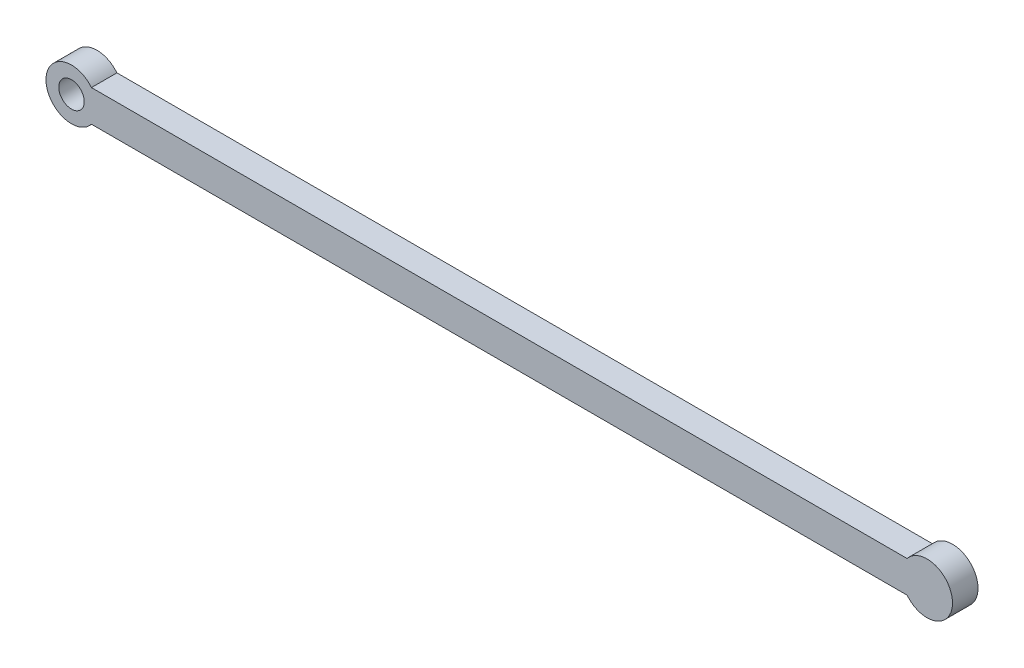
from build123d import *

# Parameters (mm, degrees)
SKETCH1_R           = 2.5
BOSS_EXTRUDE1_DEPTH = 5
SKETCH3_R           = 0.1
BOSS_EXTRUDE2_DEPTH = 0.1


with BuildPart() as part:
    # Sketch1 → Boss-Extrude1 (new body)
    with BuildSketch(Plane.XY):
        with BuildLine():
            Line((3.912222702, 3.113601376), (163.912222702, 3.113601376))
            ThreePointArc((163.912222702, 3.113601376), (172.824445404, 0), (163.912222702, -3.113601376))
            Line((163.912222702, -3.113601376), (3.912222702, -3.113601376))
            ThreePointArc((3.912222702, -3.113601376), (-5, 0), (3.912222702, 3.113601376))
        make_face()
        Circle(SKETCH1_R, mode=Mode.SUBTRACT)
    extrude(amount=BOSS_EXTRUDE1_DEPTH)

    # Sketch3 → Boss-Extrude2 (add)
    with BuildSketch(Plane(origin=(0, 0, 0), x_dir=(-1, 0, 0), z_dir=(0, 0, -1))):
        with Locations(Location((-167.824445404, 0, 0), (0, 0, 180))):
            Circle(SKETCH3_R)
    extrude(amount=BOSS_EXTRUDE2_DEPTH)


solid = part.part
